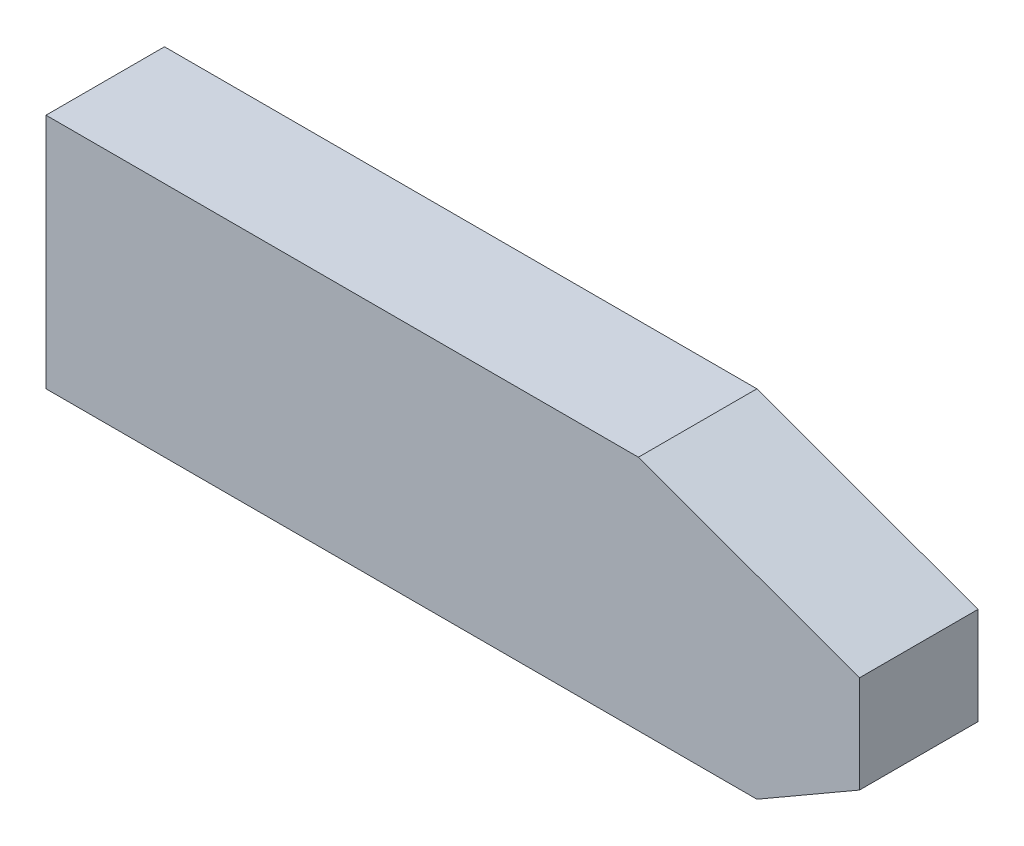
from build123d import *

# Parameters (mm, degrees)
BOSS_EXTRUDE1_DEPTH = 25.4


with BuildPart() as part:
    # Sketch1 → Boss-Extrude1 (new body)
    with BuildSketch(Plane.XY):
        Polygon((0, 0), (0, 50.8), (127, 50.8), (174.397045256, 33.548886335), (174.397045256, 12.7), (152.4, 0), align=None)
    extrude(amount=BOSS_EXTRUDE1_DEPTH)


solid = part.part
